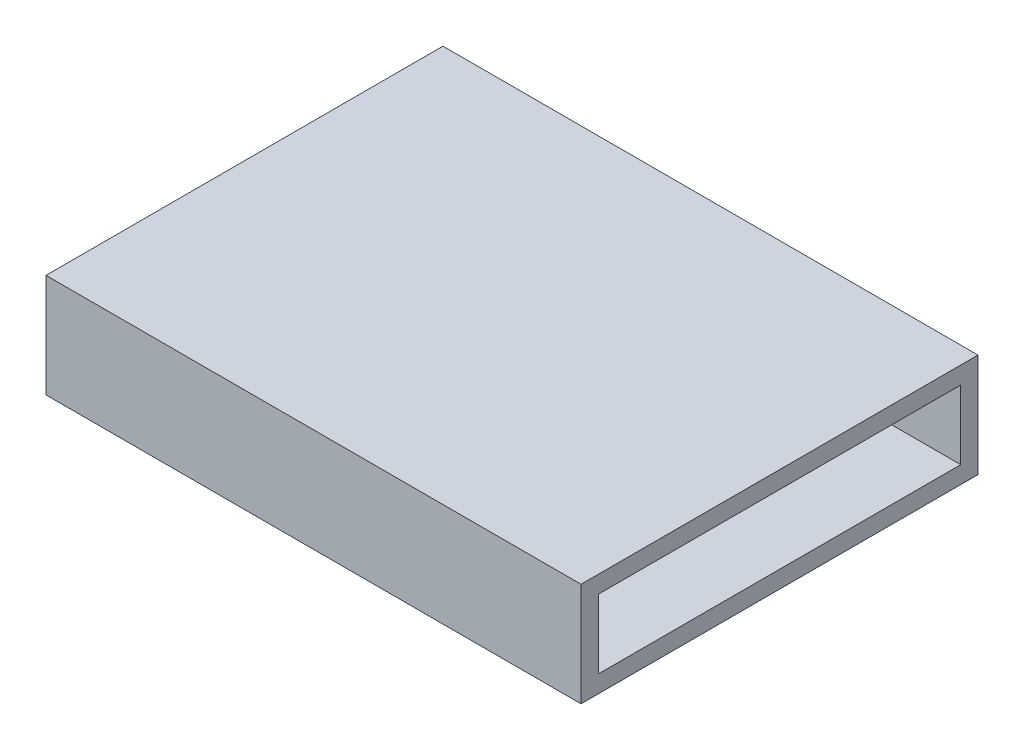
from build123d import *

# Parameters (mm, degrees)
SKETCH1_W           = 155
SKETCH1_H           = 115
BOSS_EXTRUDE1_DEPTH = 30
SKETCH2_W           = 105
SKETCH2_H           = 20
CUT_EXTRUDE1_DEPTH  = 196.320249846


with BuildPart() as part:
    # Sketch1 → Boss-Extrude1 (new body)
    with BuildSketch(Plane(origin=(0, 0, 0), x_dir=(1, 0, 0), z_dir=(0, 1, 0))):
        with Locations((77.5, 57.5)):
            Rectangle(SKETCH1_W, SKETCH1_H)
    extrude(amount=BOSS_EXTRUDE1_DEPTH)

    # Sketch2 → Cut-Extrude1 (cut, through all)
    with BuildSketch(Plane(origin=(155, 0, 0), x_dir=(0, 0, -1), z_dir=(1, 0, 0))):
        with Locations((57.5, 15)):
            Rectangle(SKETCH2_W, SKETCH2_H)
    extrude(amount=-CUT_EXTRUDE1_DEPTH, mode=Mode.SUBTRACT)


solid = part.part
